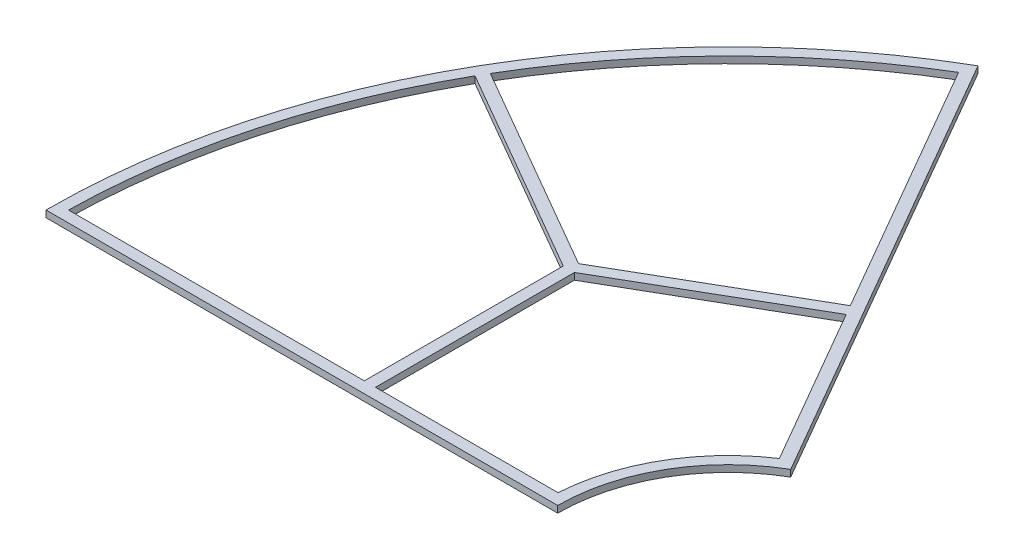
from build123d import *

# Parameters (mm, degrees)
BOSS_EXTRUDE3_DEPTH = 6


with BuildPart() as part:
    # Sketch1 → Boss-Extrude3 (new body)
    with BuildSketch(Plane(origin=(0, 0, 0), x_dir=(1, 0, 0), z_dir=(0, 1, 0))):
        with BuildLine():
            ThreePointArc((-76.2, 131.982271537), (-131.982271537, 76.2), (-152.4, 0))
            Line((-152.4, 0), (-609.6, 0))
            ThreePointArc((-609.6, 0), (-527.929086147, 304.8), (-304.8, 527.929086147))
            Line((-304.8, 527.929086147), (-76.2, 131.982271537))
        make_face()
        with BuildLine():
            Line((-335.2, 10), (-599.516605275, 10))
            ThreePointArc((-599.516605275, 10), (-578.516992176, 157.601553812), (-521.750777563, 295.459449184))
            Line((-521.750777563, 295.459449184), (-335.2, 187.75430754))
            Line((-335.2, 187.75430754), (-335.2, 10))
        make_face(mode=Mode.SUBTRACT)
        with BuildLine():
            Line((-89.706166951, 135.375638912), (-171.260254038, 276.631461311))
            Line((-171.260254038, 276.631461311), (-325.2, 187.75430754))
            Line((-325.2, 187.75430754), (-325.2, 10))
            Line((-325.2, 10), (-162.091825827, 10))
            ThreePointArc((-162.091825827, 10), (-140.642525575, 81.2), (-89.706166951, 135.375638912))
        make_face(mode=Mode.SUBTRACT)
        with BuildLine():
            Line((-330.2, 196.414561578), (-516.750777563, 304.119703222))
            ThreePointArc((-516.750777563, 304.119703222), (-425.745445365, 422.209634839), (-308.418556675, 514.196610158))
            Line((-308.418556675, 514.196610158), (-176.260254038, 285.291715349))
            Line((-176.260254038, 285.291715349), (-330.2, 196.414561578))
        make_face(mode=Mode.SUBTRACT)
    extrude(amount=BOSS_EXTRUDE3_DEPTH)


solid = part.part
